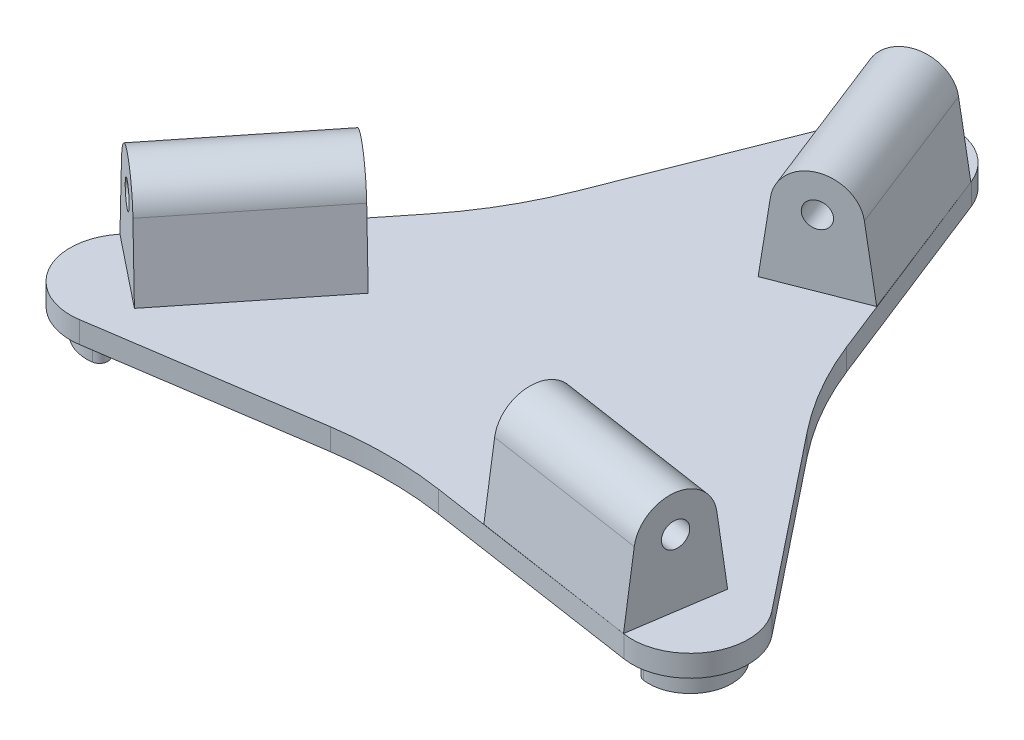
from build123d import *

# Parameters (mm, degrees)
EXTRUDE2_DEPTH     = 2.6
EXTRUDE3_DEPTH     = 3
EXTRUDE4_DEPTH     = 15
SKETCH4_R          = 1.5
CUT_EXTRUDE1_DEPTH = 30
CIRPATTERN1_COUNT  = 3


with BuildPart() as part:
    # Sketch1 → Extrude2 (new body)
    with BuildSketch(Plane(origin=(0, 0, 0), x_dir=(1, 0, 0), z_dir=(0, 1, 0))):
        with BuildLine():
            Line((-6.5, 41.572883869), (-16.221725084, 16.871170844))
            ThreePointArc((-16.221725084, 16.871170844), (-17.527996386, 13.882959965), (-19.052558883, 11))
            ThreePointArc((-19.052558883, 11), (-20.786994202, 8.238210165), (-22.721725084, 5.612840594))
            Line((-22.721725084, 5.612840594), (-39.253173539, -15.15727681))
            ThreePointArc((-39.253173539, -15.15727681), (-39.837168574, -23), (-32.753173539, -26.415607059))
            Line((-32.753173539, -26.415607059), (-6.5, -22.484011438))
            ThreePointArc((-6.5, -22.484011438), (-3.258997817, -22.12117013), (0, -22))
            ThreePointArc((0, -22), (3.258997817, -22.12117013), (6.5, -22.484011438))
            Line((6.5, -22.484011438), (32.753173539, -26.415607059))
            ThreePointArc((32.753173539, -26.415607059), (39.837168574, -23), (39.253173539, -15.15727681))
            Line((39.253173539, -15.15727681), (22.721725084, 5.612840594))
            ThreePointArc((22.721725084, 5.612840594), (20.786994202, 8.238210165), (19.052558883, 11))
            ThreePointArc((19.052558883, 11), (17.527996386, 13.882959965), (16.221725084, 16.871170844))
            Line((16.221725084, 16.871170844), (6.5, 41.572883869))
            ThreePointArc((6.5, 41.572883869), (0, 46), (-6.5, 41.572883869))
        make_face()
    extrude(amount=EXTRUDE2_DEPTH)

    # Sketch2 → Extrude3 (add)
    with BuildSketch(Plane(origin=(0, 0, 0), x_dir=(1, 0, 0), z_dir=(0, 1, 0))):
        with BuildLine():
            ThreePointArc((-33.135101254, -24.464580596), (-38.117859233, -22.00735629), (-37.754498914, -16.463549149))
            ThreePointArc((-37.754498914, -16.463549149), (-36.352384156, -16.278957239), (-36.167792243, -17.681071999))
            ThreePointArc((-36.167792243, -17.681071999), (-36.385808436, -21.007356296), (-33.396153637, -22.481690885))
            ThreePointArc((-33.396153637, -22.481690885), (-32.274182592, -23.342609551), (-33.135101254, -24.464580596))
        make_face()
        with BuildLine():
            ThreePointArc((-4.619397662, 40.928129741), (-1e-09, 44.014712579), (4.619397658, 40.928129741))
            ThreePointArc((4.619397658, 40.928129741), (4.078201562, 39.621566787), (2.771638604, 40.162762881))
            ThreePointArc((2.771638604, 40.162762881), (-1e-09, 42.014712591), (-2.771638608, 40.162762881))
            ThreePointArc((-2.771638608, 40.162762881), (-4.078201566, 39.621566787), (-4.619397662, 40.928129741))
        make_face()
        with BuildLine():
            ThreePointArc((37.754498916, -16.463549145), (38.117859234, -22.007356289), (33.135101256, -24.464580593))
            ThreePointArc((33.135101256, -24.464580593), (32.274182594, -23.342609548), (33.396153639, -22.481690882))
            ThreePointArc((33.396153639, -22.481690882), (36.385808436, -21.007356295), (36.167792245, -17.681071996))
            ThreePointArc((36.167792245, -17.681071996), (36.352384158, -16.278957236), (37.754498916, -16.463549145))
        make_face()
    extrude(amount=-EXTRUDE3_DEPTH)

    # Sketch3 → Extrude4 (add)
    with BuildSketch(Plane(origin=(0, 0, 0), x_dir=(1, 0, 0), z_dir=(0, 1, 0))):
        Polygon((6.534271094, 41.485805214), (13.834776863, 22.865853133), (3.593803219, 18.85057496), (-3.70670255, 37.470527041), align=None)
        Polygon((32.660625665, -26.40174737), (12.88502126, -23.414194786), (14.528175182, -12.537612363), (34.303779586, -15.525164948), align=None)
        Polygon((-39.194896759, -15.084057844), (-26.719798124, 0.548341653), (-18.1219784, -6.312962596), (-30.597077036, -21.945362094), align=None)
    extrude(amount=EXTRUDE4_DEPTH)

    # Sketch4 → Cut-Extrude1 (cut)
    with BuildSketch(Plane(origin=(-13.227790442, 0, -33.737501479), x_dir=(-0.9309976040748461, 0, 0.3650252884484803), z_dir=(-0.3650252884484803, 0, -0.9309976040748461))):
        with Locations((-15.726758748, 10.6)):
            Circle(SKETCH4_R)
        with BuildLine():
            Line((-21.226758748, 2.6), (-20.088533921, 11.178720432))
            ThreePointArc((-20.088533921, 11.178720432), (-15.726758748, 15), (-11.364983575, 11.178720432))
            Line((-11.364983575, 11.178720432), (-10.226758748, 2.6))
            Line((-10.226758748, 2.6), (-9.226758748, 2.6))
            Line((-9.226758748, 2.6), (-9.226758748, 16))
            Line((-9.226758748, 16), (-22.226758748, 16))
            Line((-22.226758748, 16), (-22.226758748, 2.6))
            Line((-22.226758748, 2.6), (-21.226758748, 2.6))
        make_face()
    cut_extrude1 = extrude(amount=-CUT_EXTRUDE1_DEPTH, mode=Mode.SUBTRACT)

    # CirPattern1: Cut-Extrude1 ×3 about axis
    cirpattern1_axis = Axis((0, 36.006221081, 0), (0, -1, 0))
    for i in range(1, CIRPATTERN1_COUNT):
        add(cut_extrude1.rotate(cirpattern1_axis, i * 360 / CIRPATTERN1_COUNT), mode=Mode.SUBTRACT)


solid = part.part
